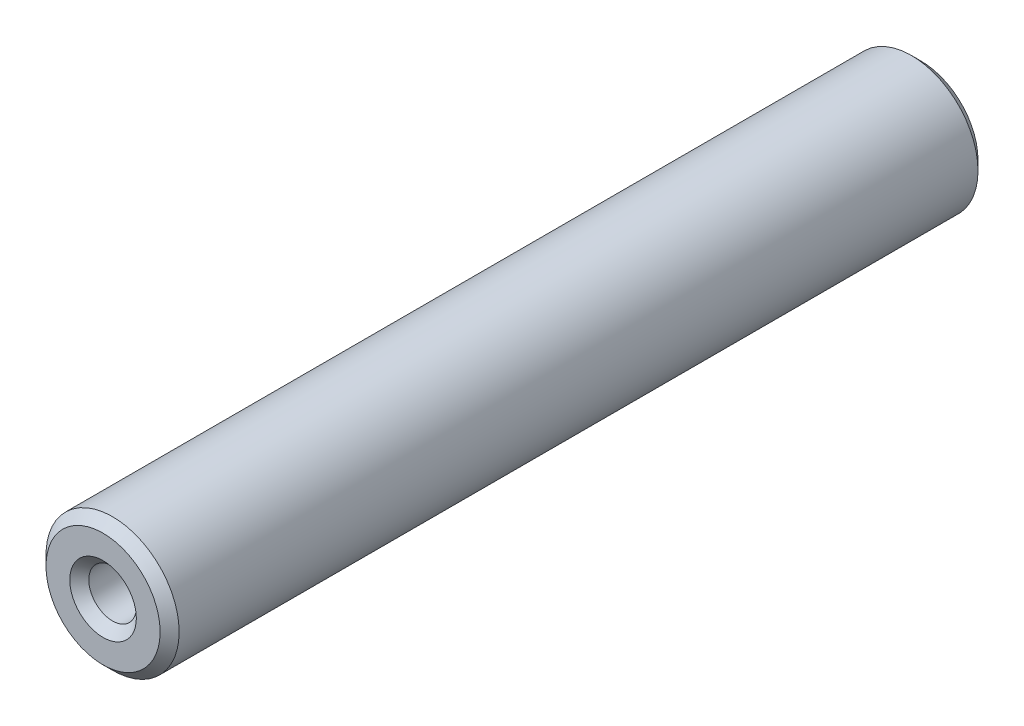
from build123d import *

# Parameters (mm, degrees)
SKETCH_1_R                       = 3.5
EXTRUDE_1_DEPTH                  = 21.5
HOLE_WIZARD_M3_1_D               = 2.5
HOLE_WIZARD_M3_1_DEPTH           = 7.5
HOLE_WIZARD_M3_1_TIP             = 0.751075774
HOLE_WIZARD_M3_1_ON_FACE_2_D     = 2.5
HOLE_WIZARD_M3_1_ON_FACE_2_DEPTH = 7.5
HOLE_WIZARD_M3_1_ON_FACE_2_TIP   = 0.751075774
CHAMFER_1_SIZE                   = 0.5


with BuildPart() as part:
    # 草图1 → 拉伸1 (new, symmetric)
    with BuildSketch(Plane.XY):
        Circle(SKETCH_1_R)
    extrude(amount=EXTRUDE_1_DEPTH, both=True)

    # M3 螺纹孔1
    with Locations(Plane.XY.offset(21.5)):
        with Locations((0, 0)):
            Hole(HOLE_WIZARD_M3_1_D / 2, depth=HOLE_WIZARD_M3_1_DEPTH)
            with Locations((0, 0, -(HOLE_WIZARD_M3_1_DEPTH + HOLE_WIZARD_M3_1_TIP / 2))):  # 118° drill point
                Cone(0, HOLE_WIZARD_M3_1_D / 2, HOLE_WIZARD_M3_1_TIP, mode=Mode.SUBTRACT)

    # M3 螺纹孔1 on face 2
    with Locations(Plane(origin=(0, 0, -21.5), x_dir=(-1, 0, 0), z_dir=(0, 0, -1))):
        with Locations((0, 0)):
            Hole(HOLE_WIZARD_M3_1_ON_FACE_2_D / 2, depth=HOLE_WIZARD_M3_1_ON_FACE_2_DEPTH)
            with Locations((0, 0, -(HOLE_WIZARD_M3_1_ON_FACE_2_DEPTH + HOLE_WIZARD_M3_1_ON_FACE_2_TIP / 2))):  # 118° drill point
                Cone(0, HOLE_WIZARD_M3_1_ON_FACE_2_D / 2, HOLE_WIZARD_M3_1_ON_FACE_2_TIP, mode=Mode.SUBTRACT)

    # 倒角1
    chamfer_1_edges = [part.edges().sort_by_distance(p)[0] for p in [
        (-3.5, 0, -21.5),
        (-3.5, 0, 21.5),
        (-1.25, 0, -21.5),
        (1.25, 0, 21.5),
    ]]
    chamfer(chamfer_1_edges, length=CHAMFER_1_SIZE)


solid = part.part
